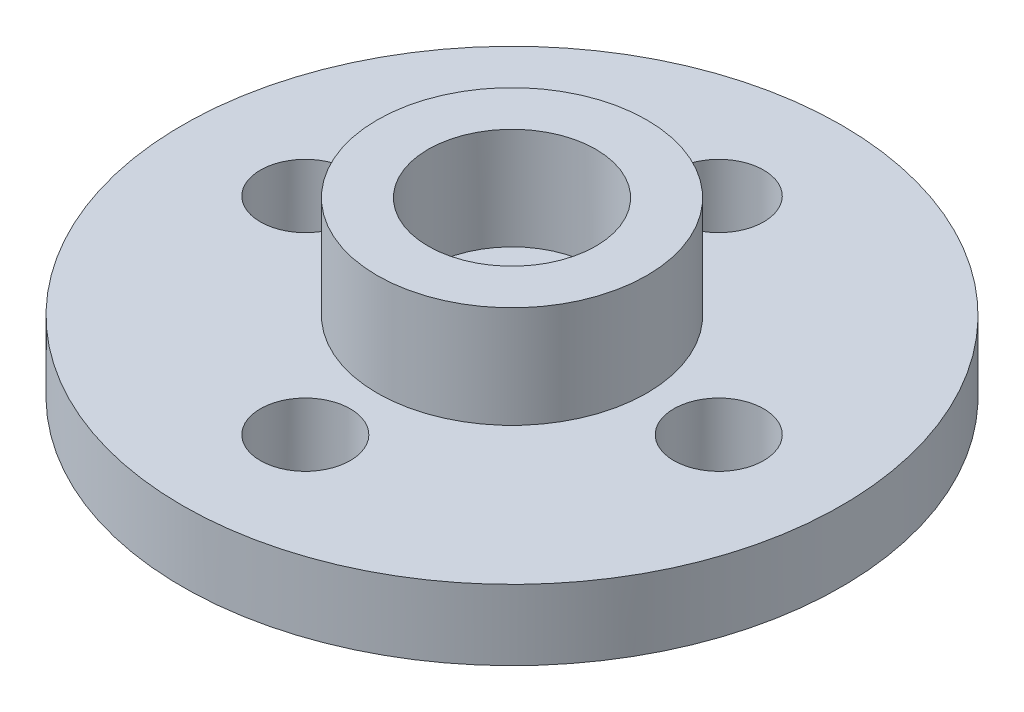
from build123d import *

# Parameters (mm, degrees)
SKETCH1_R           = 11
BOSS_EXTRUDE2_DEPTH = 5.65
SKETCH3_R           = 2.8
SKETCH3_R_2         = 1.5
CUT_EXTRUDE2_DEPTH  = 12
CUT_EXTRUDE3_START  = -4
SKETCH4_R           = 11
SKETCH4_R_2         = 4.5
CUT_EXTRUDE3_DEPTH  = 4
SKETCH5_W           = 9
SKETCH5_H           = 0.6
CUT_EXTRUDE4_DEPTH  = 18
SKETCH6_R           = 2.8
SKETCH6_R_2         = 1.5
BOSS_EXTRUDE4_DEPTH = 2.3
SKETCH7_R           = 11
SKETCH7_R_2         = 2.8
SKETCH7_R_3         = 1.5
BOSS_EXTRUDE5_DEPTH = 0.7


with BuildPart() as part:
    # Sketch1 → Boss-Extrude2 (new body)
    with BuildSketch(Plane(origin=(0, 0, 0), x_dir=(1, 0, 0), z_dir=(0, 1, 0))):
        with Locations(Location((0, 0, 0), (0, 0, 270))):
            Circle(SKETCH1_R)
    extrude(amount=BOSS_EXTRUDE2_DEPTH)

    # Sketch3 → Cut-Extrude2 (cut)
    with BuildSketch(Plane(origin=(0, 5.65, 0), x_dir=(1, 0, 0), z_dir=(0, 1, 0))):
        with Locations(Location((0, 0, 0), (0, 0, 270))):
            Circle(SKETCH3_R)
        with Locations(Location((-6.9, 0, 0), (0, 0, 270))):
            Circle(SKETCH3_R_2)
        with Locations(Location((0, 6.9, 0), (0, 0, 270))):
            Circle(SKETCH3_R_2)
        with Locations(Location((6.9, 0, 0), (0, 0, 270))):
            Circle(SKETCH3_R_2)
        with Locations(Location((0, -6.9, 0), (0, 0, 270))):
            Circle(SKETCH3_R_2)
    extrude(amount=-CUT_EXTRUDE2_DEPTH, mode=Mode.SUBTRACT)

    # Sketch4 → Cut-Extrude3 (cut)
    with BuildSketch(Plane(origin=(0, 5.65, 0), x_dir=(1, 0, 0), z_dir=(0, 1, 0)).offset(CUT_EXTRUDE3_START)):
        with Locations(Location((0, 0, 0), (0, 0, 270))):
            Circle(SKETCH4_R)
        with Locations(Location((0, 0, 0), (0, 0, 270))):
            Circle(SKETCH4_R_2, mode=Mode.SUBTRACT)
    extrude(amount=CUT_EXTRUDE3_DEPTH, mode=Mode.SUBTRACT)

    # Sketch5 → Cut-Extrude4 (cut)
    with BuildSketch(Plane(origin=(10, 0, 0), x_dir=(0, 0, -1), z_dir=(1, 0, 0))):
        with Locations((0, 5.35)):
            Rectangle(SKETCH5_W, SKETCH5_H)
    extrude(amount=-CUT_EXTRUDE4_DEPTH, mode=Mode.SUBTRACT)

    # Sketch6 → Boss-Extrude4 (add)
    with BuildSketch(Plane(origin=(0, 1.65, 0), x_dir=(1, 0, 0), z_dir=(0, 1, 0))):
        with Locations(Location((0, 0, 0), (0, 0, 270))):
            Circle(SKETCH6_R)
        with Locations(Location((0, 0, 0), (0, 0, 270))):
            Circle(SKETCH6_R_2, mode=Mode.SUBTRACT)
    extrude(amount=-BOSS_EXTRUDE4_DEPTH)

    # Sketch7 → Boss-Extrude5 (add)
    with BuildSketch(Plane.XZ):
        with Locations(Location((0, 0, 0), (0, 0, 270))):
            Circle(SKETCH7_R)
        with Locations(Location((0, 0, 0), (0, 0, 90))):
            Circle(SKETCH7_R_2, mode=Mode.SUBTRACT)
        with Locations(Location((0, 6.9, 0), (0, 0, 90))):
            Circle(SKETCH7_R_3, mode=Mode.SUBTRACT)
        with Locations(Location((6.9, 0, 0), (0, 0, 90))):
            Circle(SKETCH7_R_3, mode=Mode.SUBTRACT)
        with Locations(Location((0, -6.9, 0), (0, 0, 90))):
            Circle(SKETCH7_R_3, mode=Mode.SUBTRACT)
        with Locations(Location((-6.9, 0, 0), (0, 0, 90))):
            Circle(SKETCH7_R_3, mode=Mode.SUBTRACT)
    extrude(amount=BOSS_EXTRUDE5_DEPTH)


solid = part.part
